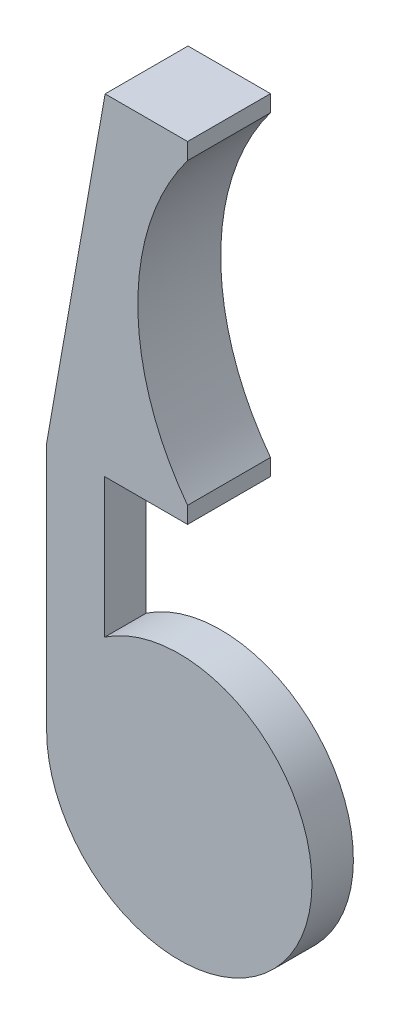
from build123d import *

# Parameters (mm, degrees)
SKETCH1_R           = 20.32
BOSS_EXTRUDE1_DEPTH = 6.35
SKETCH2_R           = 4.445
SKETCH2_R_2         = 3.175
BOSS_EXTRUDE2_DEPTH = 2.54
SKETCH4_W           = 8.89
SKETCH4_H           = 38.1
BOSS_EXTRUDE3_DEPTH = 6.35
BOSS_EXTRUDE4_DEPTH = 12.7


with BuildPart() as part:
    # Sketch1 → Boss-Extrude1 (new body)
    with BuildSketch(Plane.XY):
        Circle(SKETCH1_R)
    extrude(amount=BOSS_EXTRUDE1_DEPTH)

    # Sketch2 → Boss-Extrude2 (add)
    with BuildSketch(Plane(origin=(0, 0, 0), x_dir=(-1, 0, 0), z_dir=(0, 0, -1))):
        with Locations(Location((0, 0, 0), (0, 0, 180))):
            Circle(SKETCH2_R)
        Circle(SKETCH2_R_2, mode=Mode.SUBTRACT)
    extrude(amount=BOSS_EXTRUDE2_DEPTH)

    # Sketch4 → Boss-Extrude3 (add)
    with BuildSketch(Plane.XY.offset(6.35)):
        with Locations((-15.875, 19.05)):
            Rectangle(SKETCH4_W, SKETCH4_H)
    extrude(amount=-BOSS_EXTRUDE3_DEPTH)

    # Sketch5 → Boss-Extrude4 (add)
    with BuildSketch(Plane.XY.offset(6.35)):
        with BuildLine():
            Line((-20.32, 38.1), (-11.36258938, 88.9))
            Line((-11.36258938, 88.9), (1.27, 88.9))
            Line((1.27, 88.9), (1.27, 86.36))
            ThreePointArc((1.27, 86.36), (-6.35, 63.5), (1.27, 40.64))
            Line((1.27, 40.64), (1.27, 38.1))
            Line((1.27, 38.1), (-11.43, 38.1))
            Line((-11.43, 38.1), (-20.32, 38.1))
        make_face()
    extrude(amount=-BOSS_EXTRUDE4_DEPTH)


solid = part.part
